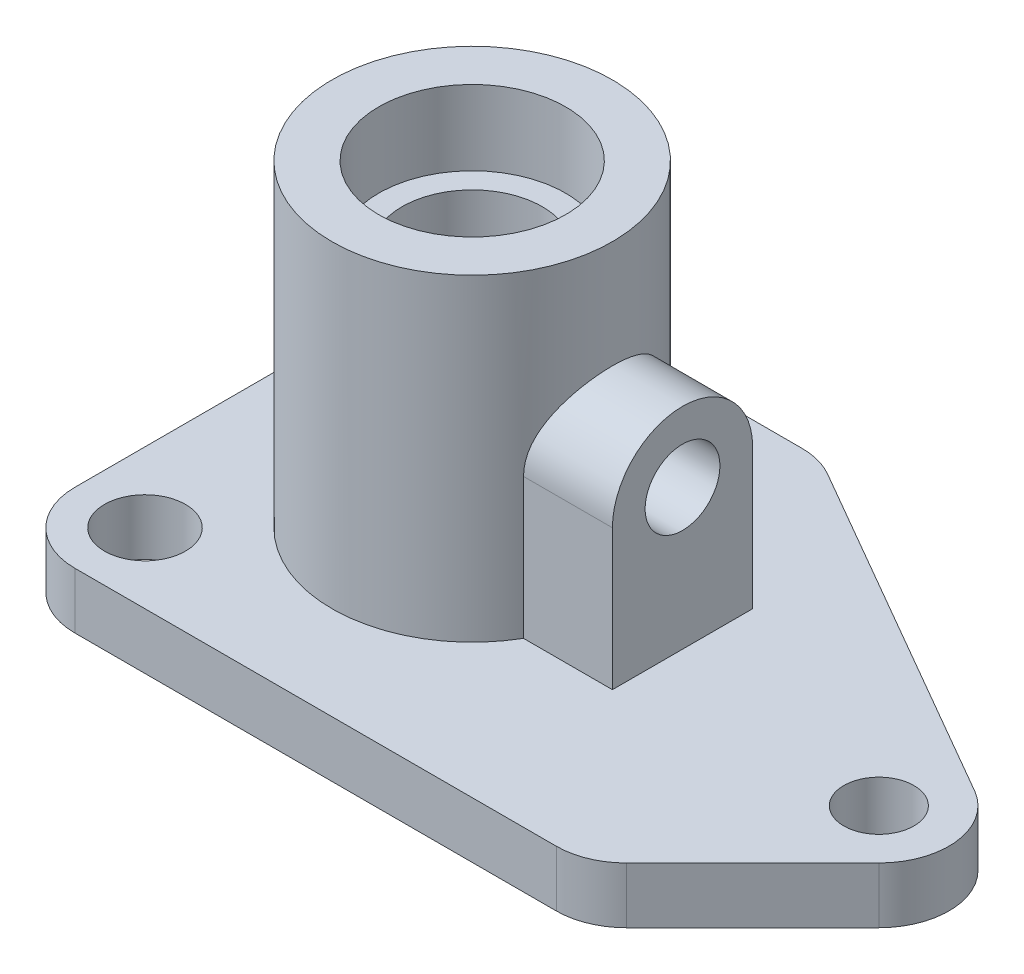
from build123d import *

# Parameters (mm, degrees)
SKETCH1_R                = 7.5
SKETCH1_R_2              = 8.667102454
BOSS_EXTRUDE1_DEPTH      = 12
SKETCH2_R                = 30
BOSS_EXTRUDE2_DEPTH      = 68
HOLE1_D                  = 30
HOLE1_DEPTH              = 80
HOLE1_CBORE_D            = 40
HOLE1_CBORE_DEPTH        = 16
HOLE1_TIP                = 9.012909285
BOSS_EXTRUDE3_REACH      = 161.452
BOSS_EXTRUDE3_END_RADIUS = 30
CUT_EXTRUDE1_REACH       = 161.452
CUT_EXTRUDE1_END_RADIUS  = 15
SKETCH7_R                = 8


with BuildPart() as part:
    # Sketch1 → Boss-Extrude1 (new body)
    with BuildSketch(Plane(origin=(0, 0, 0), x_dir=(1, 0, 0), z_dir=(0, 1, 0))):
        with BuildLine():
            Line((0, 15), (0, 85))
            ThreePointArc((0, 85), (4.393398282, 95.606601718), (15, 100))
            Line((15, 100), (70.521815275, 100))
            ThreePointArc((70.521815275, 100), (74.404100951, 99.488887394), (78.021815275, 97.990381057))
            Line((78.021815275, 97.990381057), (152.5, 54.990381057))
            ThreePointArc((152.5, 54.990381057), (159.871672921, 43.957892883), (155.606601718, 31.393398282))
            Line((155.606601718, 31.393398282), (128.606601718, 4.393398282))
            ThreePointArc((128.606601718, 4.393398282), (123.740251485, 1.141807012), (118, 0))
            Line((118, 0), (15, 0))
            ThreePointArc((15, 0), (4.393398282, 4.393398282), (0, 15))
        make_face()
        with Locations(Location((15, 85, 0), (0, 0, 270))):
            Circle(SKETCH1_R, mode=Mode.SUBTRACT)
        with Locations(Location((15, 15, 0), (0, 0, 270))):
            Circle(SKETCH1_R_2, mode=Mode.SUBTRACT)
        with Locations(Location((145, 42, 0), (0, 0, 270))):
            Circle(SKETCH1_R, mode=Mode.SUBTRACT)
    extrude(amount=BOSS_EXTRUDE1_DEPTH)

    # Sketch2 → Boss-Extrude2 (add)
    with BuildSketch(Plane(origin=(0, 12, 0), x_dir=(1, 0, 0), z_dir=(0, 1, 0))):
        with Locations(Location((50, 50, 0), (0, 0, 90))):
            Circle(SKETCH2_R)
    extrude(amount=BOSS_EXTRUDE2_DEPTH)

    # Hole1
    with Locations(Plane(origin=(0, 80, 0), x_dir=(1, 0, 0), z_dir=(0, 1, 0))):
        with Locations((50, 50)):
            CounterBoreHole(HOLE1_D / 2, HOLE1_CBORE_D / 2, HOLE1_CBORE_DEPTH, depth=HOLE1_DEPTH)
            with Locations((0, 0, -(HOLE1_DEPTH + HOLE1_TIP / 2))):  # 118° drill point
                Cone(0, HOLE1_D / 2, HOLE1_TIP, mode=Mode.SUBTRACT)

    # Boss-Extrude3: up to this cylinder (the profile starts outside it)
    boss_extrude3_end = Plane(origin=(50, 33.024623, -50), z_dir=(0, -1, 0)) * Cylinder(BOSS_EXTRUDE3_END_RADIUS, 383.904, mode=Mode.PRIVATE)
    # Sketch6 → Boss-Extrude3 (add, up to the surface)
    with BuildSketch(Plane(origin=(95, 0, 0), x_dir=(0, 0, -1), z_dir=(1, 0, 0)), mode=Mode.PRIVATE) as boss_extrude3_sk1:
        with BuildLine():
            Line((35, 42), (35, 12))
            Line((35, 12), (65, 12))
            Line((65, 12), (65, 42))
            ThreePointArc((65, 42), (50, 57), (35, 42))
        make_face()
    boss_extrude3_tool1 = extrude(boss_extrude3_sk1.sketch, amount=-BOSS_EXTRUDE3_REACH, mode=Mode.PRIVATE) - boss_extrude3_end
    add(boss_extrude3_tool1.solids().sort_by_distance((95, 33.024623, -50))[0])

    # Cut-Extrude1: up to this cylinder (the profile starts outside it)
    cut_extrude1_end = Plane(origin=(50, 42, -50), z_dir=(0, 1, 0)) * Cylinder(CUT_EXTRUDE1_END_RADIUS, 353.904, mode=Mode.PRIVATE)
    # Sketch7 → Cut-Extrude1 (cut, up to the surface)
    with BuildSketch(Plane(origin=(95, 0, 0), x_dir=(0, 0, -1), z_dir=(1, 0, 0)), mode=Mode.PRIVATE) as cut_extrude1_sk1:
        with Locations((50, 42)):
            Circle(SKETCH7_R)
    cut_extrude1_tool1 = extrude(cut_extrude1_sk1.sketch, amount=-CUT_EXTRUDE1_REACH, mode=Mode.PRIVATE) - cut_extrude1_end
    add(cut_extrude1_tool1.solids().sort_by_distance((95, 42, -50))[0], mode=Mode.SUBTRACT)


solid = part.part
